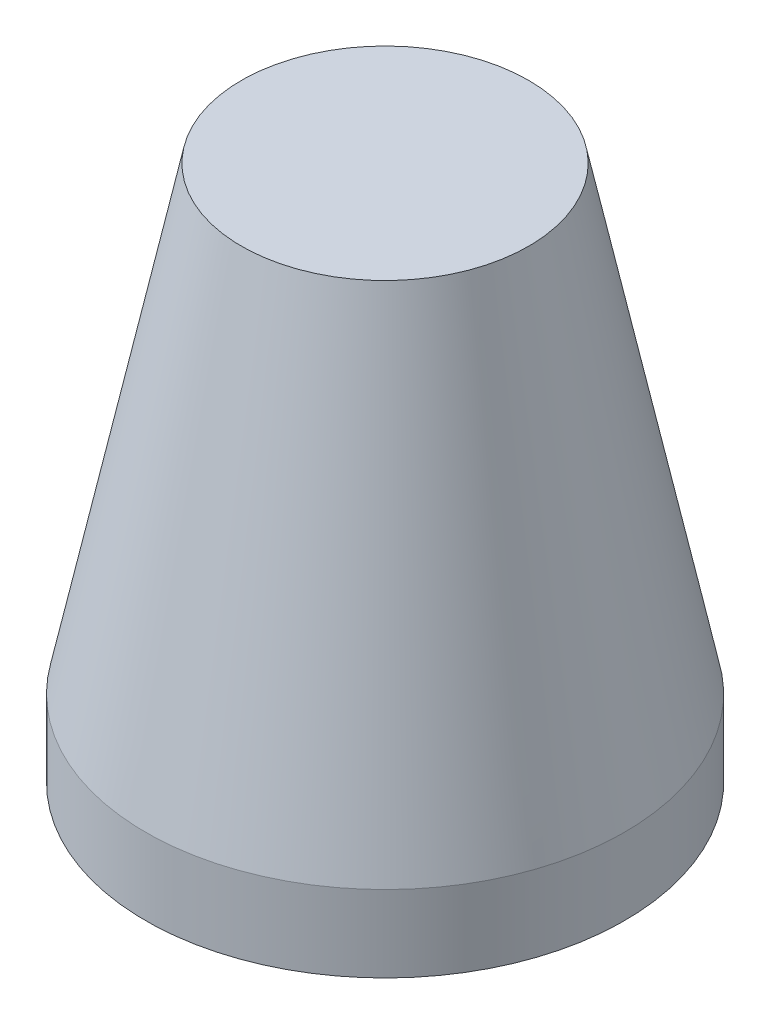
from build123d import *


with BuildPart() as part:
    # 草图1 → 旋转1 (revolve)
    with BuildSketch(Plane.XY, mode=Mode.PRIVATE) as revolve_1_sk:
        Polygon((0, 40), (-15, 40), (-25, -8), (-25, -16), (0, -16), align=None)
    revolve(revolve_1_sk.sketch.rotate(Axis((0, 0, 0), (0, 1, 0)), 270), axis=Axis((0, 0, 0), (0, 1, 0)))


solid = part.part
